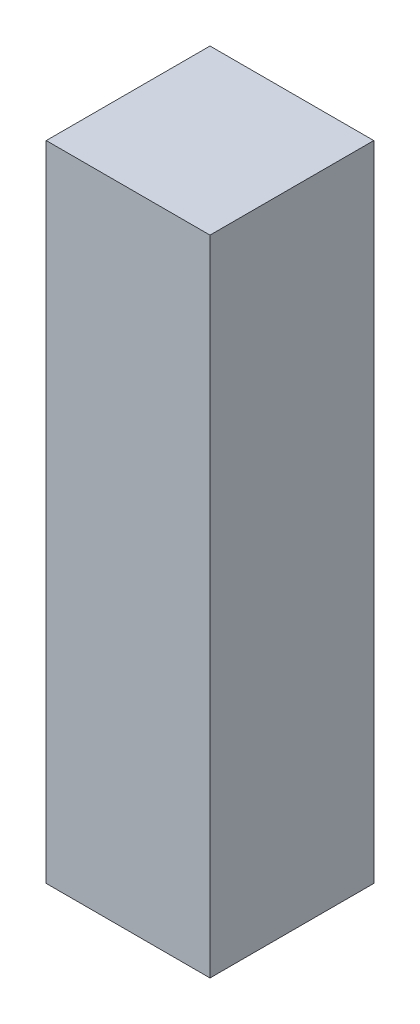
from build123d import *

# Parameters (mm, degrees)
CROQUIS1_W              = 7
CROQUIS1_H              = 7
SALIENTE_EXTRUIR1_DEPTH = 13.75


with BuildPart() as part:
    # Croquis1 → Saliente-Extruir1 (new, symmetric)
    with BuildSketch(Plane(origin=(0, 0, 0), x_dir=(1, 0, 0), z_dir=(0, 1, 0))):
        Rectangle(CROQUIS1_W, CROQUIS1_H)
    extrude(amount=SALIENTE_EXTRUIR1_DEPTH, both=True)


solid = part.part
